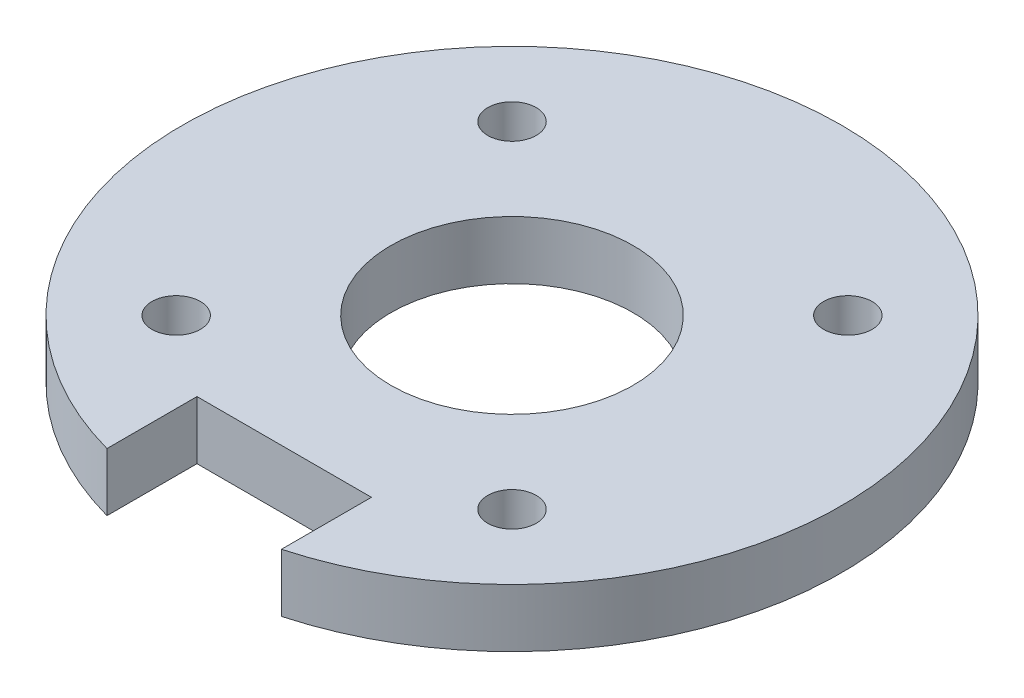
from build123d import *

# Parameters (mm, degrees)
SKETCH1_R           = 34
BOSS_EXTRUDE1_DEPTH = 6
CIRPATTERN1_COUNT   = 4
SKETCH5_R           = 12.5
CUT_EXTRUDE1_DEPTH  = 49.456165758
SKETCH7_W           = 18
SKETCH7_H           = 56.5
CUT_EXTRUDE4_DEPTH  = 49.456165758


with BuildPart() as part:
    # Sketch1 → Boss-Extrude1 (new body)
    with BuildSketch(Plane(origin=(0, 0, 0), x_dir=(1, 0, 0), z_dir=(0, 1, 0))):
        Circle(SKETCH1_R)
    extrude(amount=BOSS_EXTRUDE1_DEPTH)

    # Sketch3 → Hole1 (revolve, cut)
    with BuildSketch(Plane(origin=(17.324, 6, -17.324), x_dir=(0, 0, 1), z_dir=(1, 0, 0))):
        Polygon((0, 0), (0, 11.502151548), (2.5, 10), (2.5, 0), align=None)
    hole1 = revolve(axis=Axis((17.324, 12.35, -17.324), (0, -1, 0)), mode=Mode.SUBTRACT)

    # CirPattern1: Hole1 ×4 about axis
    cirpattern1_axis = Axis((0, 50, 0), (0, -1, 0))
    for i in range(1, CIRPATTERN1_COUNT):
        add(hole1.rotate(cirpattern1_axis, i * 360 / CIRPATTERN1_COUNT), mode=Mode.SUBTRACT)

    # Sketch5 → Cut-Extrude1 (cut, through all)
    with BuildSketch(Plane(origin=(0, 6, 0), x_dir=(1, 0, 0), z_dir=(0, 1, 0))):
        Circle(SKETCH5_R)
    extrude(amount=-CUT_EXTRUDE1_DEPTH, mode=Mode.SUBTRACT)

    # Sketch7 → Cut-Extrude4 (cut, through all)
    with BuildSketch(Plane(origin=(0, 0, 0), x_dir=(1, 0, 0), z_dir=(0, 1, 0))):
        with Locations((0, -51.75)):
            Rectangle(SKETCH7_W, SKETCH7_H)
    extrude(amount=CUT_EXTRUDE4_DEPTH, mode=Mode.SUBTRACT)


solid = part.part
